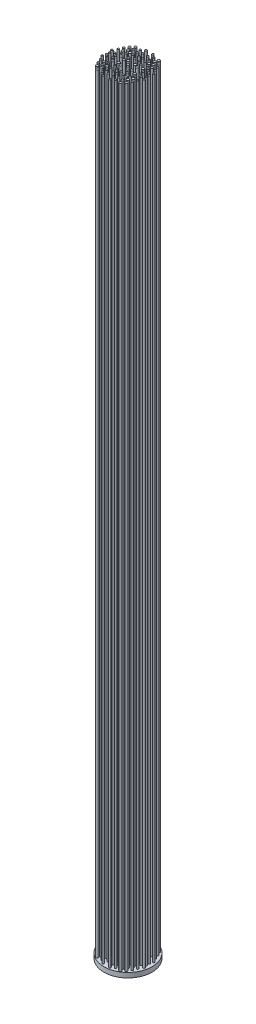
from build123d import *

# Parameters (mm, degrees)
SKETCH1_R           = 6.35
BOSS_EXTRUDE1_DEPTH = 1.27
SKETCH3_R           = 0.3175
SKETCH3_R_2         = 0.241879173
BOSS_EXTRUDE2_DEPTH = 203.2


with BuildPart() as part:
    # Sketch1 → Boss-Extrude1 (new body)
    with BuildSketch(Plane(origin=(0, 0, 0), x_dir=(1, 0, 0), z_dir=(0, 1, 0))):
        with Locations(Location((0, 0, 0), (0, 0, 270))):
            Circle(SKETCH1_R)
    extrude(amount=BOSS_EXTRUDE1_DEPTH)

    # Sketch3 → Boss-Extrude2 (add)
    with BuildSketch(Plane(origin=(0, 1.27, 0), x_dir=(1, 0, 0), z_dir=(0, 1, 0))):
        with Locations(Location((0, 0, 0), (0, 0, 270))):
            Circle(SKETCH3_R)
        with Locations(Location((-2.808868491, 4.260623871, 0), (0, 0, 270))):
            Circle(SKETCH3_R)
        with Locations(Location((-2.512628795, 3.05823922, 0), (0, 0, 270))):
            Circle(SKETCH3_R)
        with Locations(Location((-3.349070291, 3.371904781, 0), (0, 0, 270))):
            Circle(SKETCH3_R)
        with Locations(Location((-3.854420361, 2.483185692, 0), (0, 0, 270))):
            Circle(SKETCH3_R)
        with Locations(Location((-4.464325619, 3.371904781, 0), (0, 0, 270))):
            Circle(SKETCH3_R_2)
        with Locations(Location((-4.872626677, 2.343778776, 0), (0, 0, 270))):
            Circle(SKETCH3_R_2)
        with Locations(Location((-5.492451624, 1.263375176, 0), (0, 0, 270))):
            Circle(SKETCH3_R_2)
        with Locations(Location((-4.494625943, 0.987848066, 0), (0, 0, 270))):
            Circle(SKETCH3_R_2)
        with Locations(Location((-2.878986616, 1.106542396, 0), (0, 0, 270))):
            Circle(SKETCH3_R)
        with Locations(Location((-3.639219266, 1.768725247, 0), (0, 0, 270))):
            Circle(SKETCH3_R_2)
        with Locations(Location((-1.641335569, 1.768725247, 0), (0, 0, 270))):
            Circle(SKETCH3_R_2)
        with Locations(Location((-1.641335569, 4.034087632, 0), (0, 0, 270))):
            Circle(SKETCH3_R_2)
        with Locations(Location((-1.763316621, 5.044787773, 0), (0, 0, 270))):
            Circle(SKETCH3_R_2)
        with Locations(Location((-0.90944926, 5.672118896, 0), (0, 0, 270))):
            Circle(SKETCH3_R_2)
        with Locations(Location((-0.635, 4.574289432, 0), (0, 0, 270))):
            Circle(SKETCH3_R_2)
        with Locations(Location((-0.508, 3.424597041, 0), (0, 0, 270))):
            Circle(SKETCH3_R_2)
        with Locations(Location((-0.6096, 2.343778776, 0), (0, 0, 270))):
            Circle(SKETCH3_R_2)
        with Locations(Location((-2.878986616, 2.343778776, 0), (0, 0, 270))):
            Circle(SKETCH3_R_2)
        with Locations(Location((-0.90944926, 0.987848066, 0), (0, 0, 270))):
            Circle(SKETCH3_R)
        with Locations(Location((-1.763316621, 0.713531633, 0), (0, 0, 270))):
            Circle(SKETCH3_R)
        with Locations(Location((-3.639219266, 0.383082599, 0), (0, 0, 270))):
            Circle(SKETCH3_R_2)
        with Locations(Location((-5.216924514, 0.383082599, 0), (0, 0, 270))):
            Circle(SKETCH3_R_2)
        with Locations(Location((-1.641335569, 2.918832304, 0), (0, 0, 270))):
            Circle(SKETCH3_R_2)
        with Locations(Location((-3.052830594, 5.044787773, 0), (0, 0, 270))):
            Circle(SKETCH3_R)
        with Locations(Location((-3.854420361, 4.260623871, 0), (0, 0, 270))):
            Circle(SKETCH3_R)
        with Locations(Location((-3.854420361, -4.260623871, 0), (0, 0, 90))):
            Circle(SKETCH3_R)
        with Locations(Location((-3.052830594, -5.044787773, 0), (0, 0, 90))):
            Circle(SKETCH3_R)
        with Locations(Location((-1.641335569, -2.918832304, 0), (0, 0, 90))):
            Circle(SKETCH3_R_2)
        with Locations(Location((-5.216924514, -0.383082599, 0), (0, 0, 90))):
            Circle(SKETCH3_R_2)
        with Locations(Location((-3.639219266, -0.383082599, 0), (0, 0, 90))):
            Circle(SKETCH3_R_2)
        with Locations(Location((-1.763316621, -0.713531633, 0), (0, 0, 90))):
            Circle(SKETCH3_R)
        with Locations(Location((-0.90944926, -0.987848066, 0), (0, 0, 90))):
            Circle(SKETCH3_R)
        with Locations(Location((-2.878986616, -2.343778776, 0), (0, 0, 90))):
            Circle(SKETCH3_R_2)
        with Locations(Location((-0.6096, -2.343778776, 0), (0, 0, 90))):
            Circle(SKETCH3_R_2)
        with Locations(Location((-0.508, -3.424597041, 0), (0, 0, 90))):
            Circle(SKETCH3_R_2)
        with Locations(Location((-0.635, -4.574289432, 0), (0, 0, 90))):
            Circle(SKETCH3_R_2)
        with Locations(Location((-0.90944926, -5.672118896, 0), (0, 0, 90))):
            Circle(SKETCH3_R_2)
        with Locations(Location((-1.763316621, -5.044787773, 0), (0, 0, 90))):
            Circle(SKETCH3_R_2)
        with Locations(Location((-1.641335569, -4.034087632, 0), (0, 0, 90))):
            Circle(SKETCH3_R_2)
        with Locations(Location((-1.641335569, -1.768725247, 0), (0, 0, 90))):
            Circle(SKETCH3_R_2)
        with Locations(Location((-3.639219266, -1.768725247, 0), (0, 0, 90))):
            Circle(SKETCH3_R_2)
        with Locations(Location((-2.878986616, -1.106542396, 0), (0, 0, 90))):
            Circle(SKETCH3_R)
        with Locations(Location((-4.494625943, -0.987848066, 0), (0, 0, 90))):
            Circle(SKETCH3_R_2)
        with Locations(Location((-5.492451624, -1.263375176, 0), (0, 0, 90))):
            Circle(SKETCH3_R_2)
        with Locations(Location((-4.872626677, -2.343778776, 0), (0, 0, 90))):
            Circle(SKETCH3_R_2)
        with Locations(Location((-4.464325619, -3.371904781, 0), (0, 0, 90))):
            Circle(SKETCH3_R_2)
        with Locations(Location((-3.854420361, -2.483185692, 0), (0, 0, 90))):
            Circle(SKETCH3_R)
        with Locations(Location((-3.349070291, -3.371904781, 0), (0, 0, 90))):
            Circle(SKETCH3_R)
        with Locations(Location((-2.512628795, -3.05823922, 0), (0, 0, 90))):
            Circle(SKETCH3_R)
        with Locations(Location((-2.808868491, -4.260623871, 0), (0, 0, 90))):
            Circle(SKETCH3_R)
        with Locations(Location((2.808868491, -4.260623871, 0), (0, 0, 270))):
            Circle(SKETCH3_R)
        with Locations(Location((2.512628795, -3.05823922, 0), (0, 0, 270))):
            Circle(SKETCH3_R)
        with Locations(Location((3.349070291, -3.371904781, 0), (0, 0, 270))):
            Circle(SKETCH3_R)
        with Locations(Location((3.854420361, -2.483185692, 0), (0, 0, 270))):
            Circle(SKETCH3_R)
        with Locations(Location((4.464325619, -3.371904781, 0), (0, 0, 270))):
            Circle(SKETCH3_R_2)
        with Locations(Location((4.872626677, -2.343778776, 0), (0, 0, 270))):
            Circle(SKETCH3_R_2)
        with Locations(Location((5.492451624, -1.263375176, 0), (0, 0, 270))):
            Circle(SKETCH3_R_2)
        with Locations(Location((4.494625943, -0.987848066, 0), (0, 0, 270))):
            Circle(SKETCH3_R_2)
        with Locations(Location((2.878986616, -1.106542396, 0), (0, 0, 270))):
            Circle(SKETCH3_R)
        with Locations(Location((3.639219266, -1.768725247, 0), (0, 0, 270))):
            Circle(SKETCH3_R_2)
        with Locations(Location((1.641335569, -1.768725247, 0), (0, 0, 270))):
            Circle(SKETCH3_R_2)
        with Locations(Location((1.641335569, -4.034087632, 0), (0, 0, 270))):
            Circle(SKETCH3_R_2)
        with Locations(Location((1.763316621, -5.044787773, 0), (0, 0, 270))):
            Circle(SKETCH3_R_2)
        with Locations(Location((0.90944926, -5.672118896, 0), (0, 0, 270))):
            Circle(SKETCH3_R_2)
        with Locations(Location((0.635, -4.574289432, 0), (0, 0, 270))):
            Circle(SKETCH3_R_2)
        with Locations(Location((0.508, -3.424597041, 0), (0, 0, 270))):
            Circle(SKETCH3_R_2)
        with Locations(Location((0.6096, -2.343778776, 0), (0, 0, 270))):
            Circle(SKETCH3_R_2)
        with Locations(Location((2.878986616, -2.343778776, 0), (0, 0, 270))):
            Circle(SKETCH3_R_2)
        with Locations(Location((0.90944926, -0.987848066, 0), (0, 0, 270))):
            Circle(SKETCH3_R)
        with Locations(Location((1.763316621, -0.713531633, 0), (0, 0, 270))):
            Circle(SKETCH3_R)
        with Locations(Location((3.639219266, -0.383082599, 0), (0, 0, 270))):
            Circle(SKETCH3_R_2)
        with Locations(Location((5.216924514, -0.383082599, 0), (0, 0, 270))):
            Circle(SKETCH3_R_2)
        with Locations(Location((1.641335569, -2.918832304, 0), (0, 0, 270))):
            Circle(SKETCH3_R_2)
        with Locations(Location((3.052830594, -5.044787773, 0), (0, 0, 270))):
            Circle(SKETCH3_R)
        with Locations(Location((3.854420361, -4.260623871, 0), (0, 0, 270))):
            Circle(SKETCH3_R)
        with Locations(Location((3.854420361, 4.260623871, 0), (0, 0, 90))):
            Circle(SKETCH3_R)
        with Locations(Location((3.052830594, 5.044787773, 0), (0, 0, 90))):
            Circle(SKETCH3_R)
        with Locations(Location((1.641335569, 2.918832304, 0), (0, 0, 90))):
            Circle(SKETCH3_R_2)
        with Locations(Location((5.216924514, 0.383082599, 0), (0, 0, 90))):
            Circle(SKETCH3_R_2)
        with Locations(Location((3.639219266, 0.383082599, 0), (0, 0, 90))):
            Circle(SKETCH3_R_2)
        with Locations(Location((1.763316621, 0.713531633, 0), (0, 0, 90))):
            Circle(SKETCH3_R)
        with Locations(Location((0.90944926, 0.987848066, 0), (0, 0, 90))):
            Circle(SKETCH3_R)
        with Locations(Location((2.878986616, 2.343778776, 0), (0, 0, 90))):
            Circle(SKETCH3_R_2)
        with Locations(Location((0.6096, 2.343778776, 0), (0, 0, 90))):
            Circle(SKETCH3_R_2)
        with Locations(Location((0.508, 3.424597041, 0), (0, 0, 90))):
            Circle(SKETCH3_R_2)
        with Locations(Location((0.635, 4.574289432, 0), (0, 0, 90))):
            Circle(SKETCH3_R_2)
        with Locations(Location((0.90944926, 5.672118896, 0), (0, 0, 90))):
            Circle(SKETCH3_R_2)
        with Locations(Location((1.763316621, 5.044787773, 0), (0, 0, 90))):
            Circle(SKETCH3_R_2)
        with Locations(Location((1.641335569, 4.034087632, 0), (0, 0, 90))):
            Circle(SKETCH3_R_2)
        with Locations(Location((1.641335569, 1.768725247, 0), (0, 0, 90))):
            Circle(SKETCH3_R_2)
        with Locations(Location((3.639219266, 1.768725247, 0), (0, 0, 90))):
            Circle(SKETCH3_R_2)
        with Locations(Location((2.878986616, 1.106542396, 0), (0, 0, 90))):
            Circle(SKETCH3_R)
        with Locations(Location((4.494625943, 0.987848066, 0), (0, 0, 90))):
            Circle(SKETCH3_R_2)
        with Locations(Location((5.492451624, 1.263375176, 0), (0, 0, 90))):
            Circle(SKETCH3_R_2)
        with Locations(Location((4.872626677, 2.343778776, 0), (0, 0, 90))):
            Circle(SKETCH3_R_2)
        with Locations(Location((4.464325619, 3.371904781, 0), (0, 0, 90))):
            Circle(SKETCH3_R_2)
        with Locations(Location((3.854420361, 2.483185692, 0), (0, 0, 90))):
            Circle(SKETCH3_R)
        with Locations(Location((3.349070291, 3.371904781, 0), (0, 0, 90))):
            Circle(SKETCH3_R)
        with Locations(Location((2.512628795, 3.05823922, 0), (0, 0, 90))):
            Circle(SKETCH3_R)
        with Locations(Location((2.808868491, 4.260623871, 0), (0, 0, 90))):
            Circle(SKETCH3_R)
    extrude(amount=BOSS_EXTRUDE2_DEPTH)


solid = part.part
